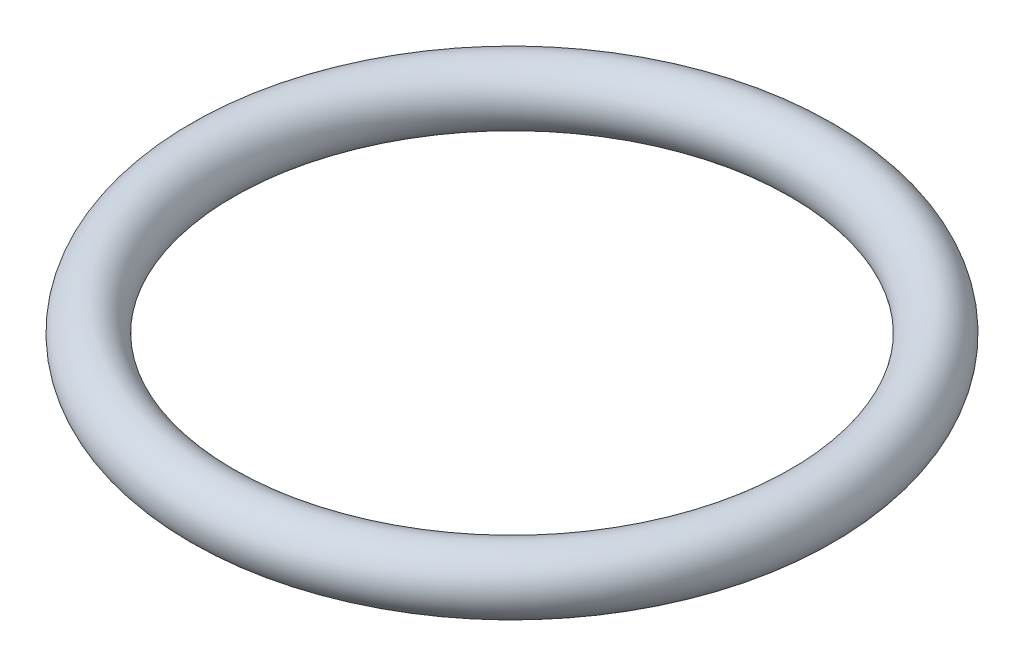
from build123d import *

# Parameters (mm, degrees)
SKETCH1_R = 1.27


with BuildPart() as part:
    # Sketch1 → Revolve1 (revolve)
    with BuildSketch(Plane.XY):
        with Locations((-12.7, 0)):
            Circle(SKETCH1_R)
    revolve(axis=Axis((0, -16.033921324, 0), (0, 1, 0)))


solid = part.part
